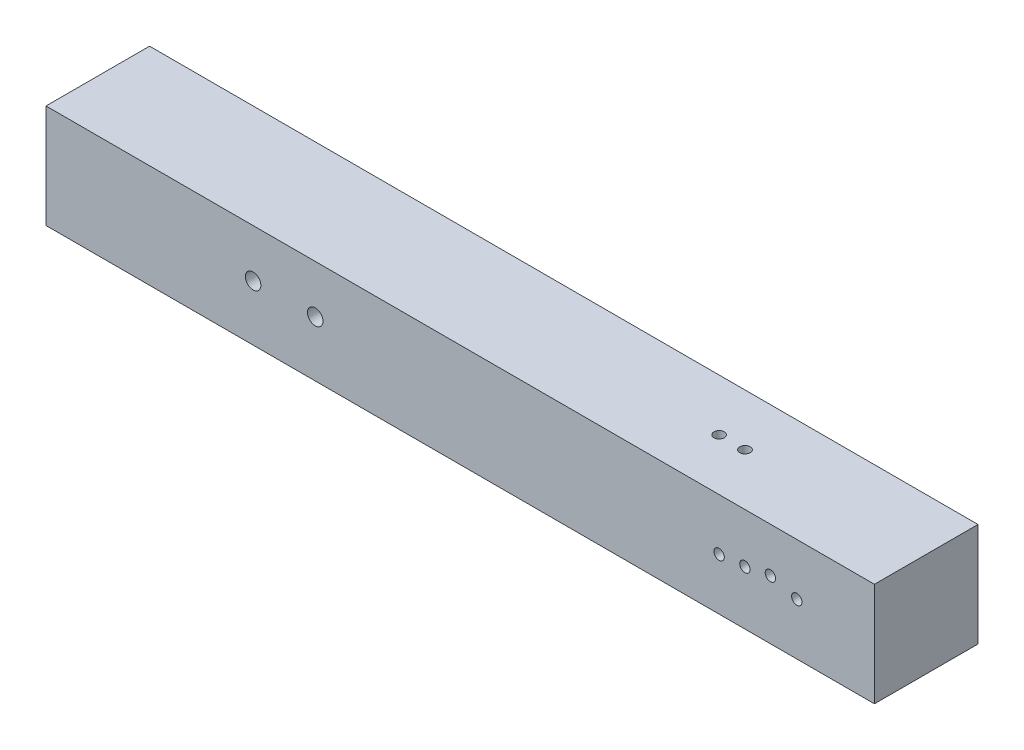
from build123d import *

# Parameters (mm, degrees)
SKETCH2_W           = 203.2
SKETCH2_H           = 25.4
BOSS_EXTRUDE1_DEPTH = 12.7
SKETCH13_R          = 1.27
CUT_EXTRUDE2_DEPTH  = 207.350575478
SKETCH16_R          = 1.905
CUT_EXTRUDE4_DEPTH  = 207.350575478


with BuildPart() as part:
    # Sketch2 → Boss-Extrude1 (new, symmetric)
    with BuildSketch(Plane.XY):
        with Locations((101.6, 12.7)):
            Rectangle(SKETCH2_W, SKETCH2_H)
    extrude(amount=BOSS_EXTRUDE1_DEPTH, both=True)

    # Sketch13 → Cut-Extrude2 (cut, through all)
    with BuildSketch(Plane.XY.offset(12.7)):
        with Locations((165.1, 12.7)):
            Circle(SKETCH13_R)
        with Locations((184.15, 12.7)):
            Circle(SKETCH13_R)
        with Locations((171.425836333, 13.253438966)):
            Circle(SKETCH13_R)
        with Locations((177.676404473, 14.467498382)):
            Circle(SKETCH13_R)
    extrude(amount=-CUT_EXTRUDE2_DEPTH, mode=Mode.SUBTRACT)

    # Sketch18 → Cut-Revolve2 (revolve, cut)
    with BuildSketch(Plane.XY, mode=Mode.PRIVATE) as cut_revolve2_sk:
        Polygon((152.4, 25.4), (153.67, 25.4), (153.67, 15.24), (152.4, 13.040295474), align=None)
    cut_revolve2 = revolve(cut_revolve2_sk.sketch.rotate(Axis((152.4, 13.040295474, 0), (0, 1, 0)), 90), axis=Axis((152.4, 13.040295474, 0), (0, 1, 0)), mode=Mode.SUBTRACT)

    # Mirror2: Cut-Revolve2 across plane
    add(cut_revolve2.mirror(Plane(origin=(155.575, 0, 0), x_dir=(0, 0, 1), z_dir=(1, 0, 0))), mode=Mode.SUBTRACT)

    # Sketch16 → Cut-Extrude4 (cut, through all)
    with BuildSketch(Plane.XY.offset(12.7)):
        with Locations((50.8, 13.625917973)):
            Circle(SKETCH16_R)
        with Locations((66.04, 13.625917973)):
            Circle(SKETCH16_R)
    extrude(amount=-CUT_EXTRUDE4_DEPTH, mode=Mode.SUBTRACT)


solid = part.part
